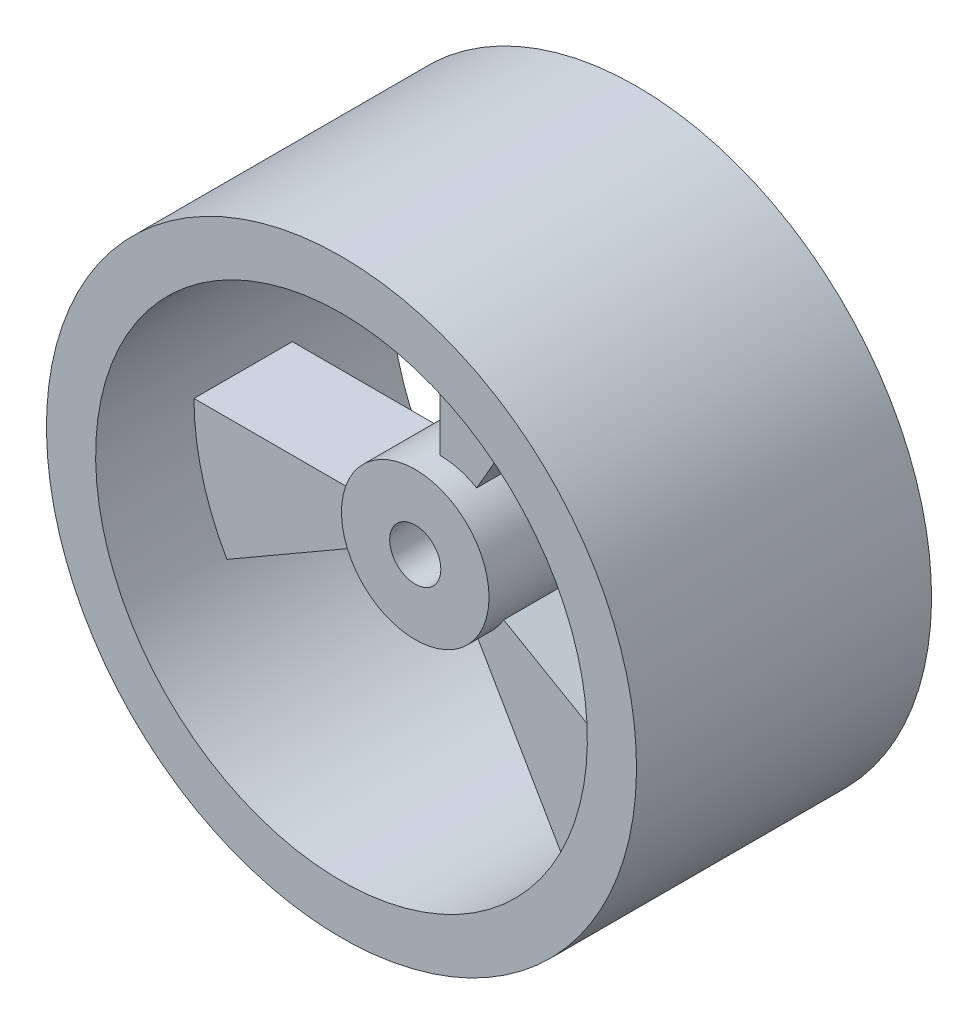
from build123d import *
from build123d.topology import SkipClean

# Parameters (mm, degrees)
CUT_EXTRUDE1_DEPTH = 47.904157598234306
CIRPATTERN2_COUNT  = 3
SKETCH8_R          = 2.6000000000000005
CUT_EXTRUDE2_DEPTH = 49.02343178074637


with BuildPart() as part:
    # Sketch5 → Revolve2 (revolve)
    with BuildSketch(Plane(origin=(0, 0, 0), x_dir=(0, 0, -1), z_dir=(1, 0, 0))):
        Polygon((-5.000000000000004, 7.5), (-5.000000000000003, 25), (-14.999999999999998, 24.999999999999996), (-14.999999999999998, 30), (14.999999999999998, 30), (14.999999999999998, 24.999999999999996), (5.000000000000003, 25), (5.000000000000004, 7.5), (7.5, 7.499999999999998), (7.499999999999998, -4.8e-16), (-7.499999999999998, -4.8e-16), (-7.5, 7.499999999999998), align=None)
    revolve(axis=Axis((0, 7.4e-16, -11.452014829998802), (0, -1.8e-16, 1)))

    # Sketch7 → Cut-Extrude1 (cut, through all)
    with SkipClean():  # the faces are left unmerged after this step: merging them gives an invalid solid
        with BuildSketch(Plane.XY.offset(5)):
            with BuildLine():
                Line((0, 7.499999999999999), (-2.7040460461e-06, 24.99999999999999))
                ThreePointArc((-2.7040460461e-06, 24.99999999999999), (-17.677670485688406, 17.67766857363911), (-25, -1.041e-14))
                Line((-25, -1.041e-14), (-7.500000000000001, -1.82e-15))
                ThreePointArc((-7.500000000000001, -1.82e-15), (-5.303300858899107, 5.303300858899106), (0, 7.499999999999999))
            make_face()
        cut_extrude1 = extrude(amount=-CUT_EXTRUDE1_DEPTH, mode=Mode.SUBTRACT)

    # CirPattern2: Cut-Extrude1 ×3 about axis
    cirpattern2_axis = Axis((4.4e-16, -2.5e-16, 0), (0, 0, 1))
    for i in range(1, CIRPATTERN2_COUNT):
        add(cut_extrude1.rotate(cirpattern2_axis, i * 360 / CIRPATTERN2_COUNT), mode=Mode.SUBTRACT)

    # Sketch8 → Cut-Extrude2 (cut, through all)
    with BuildSketch(Plane(origin=(0, 1.38e-15, -7.5), x_dir=(-1, 0, 0), z_dir=(0, 1.8e-16, -1))):
        with Locations(Location((0, 0, 0), (0, 0, 90))):
            Circle(SKETCH8_R)
    extrude(amount=-CUT_EXTRUDE2_DEPTH, mode=Mode.SUBTRACT)


solid = part.part
